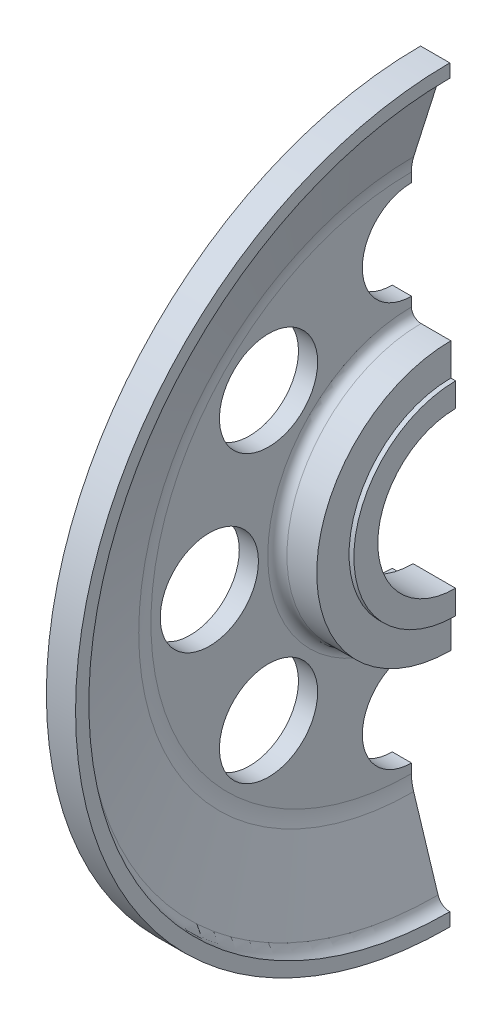
from build123d import *
from build123d.topology import SkipClean

# Parameters (mm, degrees)
FORO_START              = 60
SKETCH2_R               = 41
FORO_DEPTH              = 120
PATTERNFORI_COUNT       = 8
CUT_EXTRUDE1_DEPTH      = 597.549083718
CUT_EXTRUDE1_DEPTH_BACK = 597.549083718
SKETCH4_W               = 165.941621871
SKETCH4_H               = 884.81830511
CUT_EXTRUDE2_DEPTH      = 597.549083718
CUT_EXTRUDE2_DEPTH_BACK = 597.549083718
SKETCH5_W               = 398.645637441
SKETCH5_H               = 571.659634656


with BuildPart() as part:
    # Sketch1 → Puleggia (revolve)
    with BuildSketch(Plane.XY):
        with BuildLine():
            Line((14.305754261, 90.102284872), (23.610406599, 119.612871865))
            Line((23.610406599, 119.612871865), (48, 119.612871865))
            Line((48, 119.612871865), (48, 108.49032691))
            ThreePointArc((48, 108.49032691), (41.937089486, 106.505733817), (38.221197059, 101.320211941))
            Line((38.221197059, 101.320211941), (17.85132197, 36.715221983))
            ThreePointArc((17.85132197, 36.715221983), (16.465539581, 30.77192545), (16, 24.686990003))
            Line((16, 24.686990003), (16, -72.887128135))
            ThreePointArc((16, -72.887128135), (18.343145751, -78.543982385), (24, -80.887128135))
            Line((24, -80.887128135), (48.9, -80.887128135))
            Line((48.9, -80.887128135), (48.9, -115.887128135))
            Line((48.9, -115.887128135), (0, -115.887128135))
            Line((0, -115.887128135), (0, 79.612871865))
            ThreePointArc((0, 79.612871865), (8.869644725, 82.516202801), (14.305754261, 90.102284872))
        make_face()
    puleggia = revolve(axis=Axis((-62.254886415, -192.887128135, 0), (1, 0, 0)))

    # Mirror 2: Puleggia across plane
    with SkipClean():  # the faces are left unmerged after this step: merging them gives an invalid solid
        add(puleggia.mirror(Plane(origin=(0, 79.612871865, 0), x_dir=(0, 0, 1), z_dir=(1, 0, 0))))

    # Sketch2 → Foro (cut)
    with SkipClean():  # the faces are left unmerged after this step: merging them gives an invalid solid
        with BuildSketch(Plane(origin=(0, 0, 0), x_dir=(0, 0, -1), z_dir=(1, 0, 0)).offset(FORO_START)):
            with Locations((0, -24.100069066)):
                Circle(SKETCH2_R)
        foro = extrude(amount=-FORO_DEPTH, mode=Mode.SUBTRACT)

    # PatternFori: Foro ×8 about axis
    with SkipClean():  # the faces are left unmerged after this step: merging them gives an invalid solid
        patternfori_axis = Axis((48.9, -192.887128135, 0), (-1, 0, 0))
        for i in range(1, PATTERNFORI_COUNT):
            add(foro.rotate(patternfori_axis, i * 360 / PATTERNFORI_COUNT), mode=Mode.SUBTRACT)

    # Sketch3 → Revolve1 (revolve)
    with SkipClean():  # the faces are left unmerged after this step: merging them gives an invalid solid
        with BuildSketch(Plane.XY):
            Polygon((48.9, -115.887128135), (48.9, -107.887128135), (52.9, -107.887128135), (52.9, -127.887128135), (48.203298426, -127.887128135), (17.4, -127.887128135), (17.4, -115.887128135), align=None)
        revolve1 = revolve(axis=Axis((48.9, -192.887128135, 0), (-1, 0, 0)))

    # Mirror1: Revolve1 across plane
    with SkipClean():  # the faces are left unmerged after this step: merging them gives an invalid solid
        add(revolve1.mirror(Plane(origin=(0, 0, 0), x_dir=(0, 0, 1), z_dir=(1, 0, 0))))

    # Sketch4 → Cut-Extrude1 (cut, two sides: drawn at the far end of the back side and taken through both)
    with BuildSketch(Plane.XY.offset(-CUT_EXTRUDE1_DEPTH_BACK)):
        with Locations((-82.970810936, -207.065039304)):
            Rectangle(SKETCH4_W, SKETCH4_H)
    extrude(amount=CUT_EXTRUDE1_DEPTH + CUT_EXTRUDE1_DEPTH_BACK, mode=Mode.SUBTRACT)

    # Sketch5 → Cut-Extrude2 (cut, two sides: drawn at the far end of the back side and taken through both)
    with BuildSketch(Plane(origin=(0, 0, 0), x_dir=(1, 0, 0), z_dir=(0, 1, 0)).offset(-CUT_EXTRUDE2_DEPTH_BACK)):
        with Locations((15.58753589, 285.829817328)):
            Rectangle(SKETCH5_W, SKETCH5_H)
    extrude(amount=CUT_EXTRUDE2_DEPTH + CUT_EXTRUDE2_DEPTH_BACK, mode=Mode.SUBTRACT)


solid = part.part
